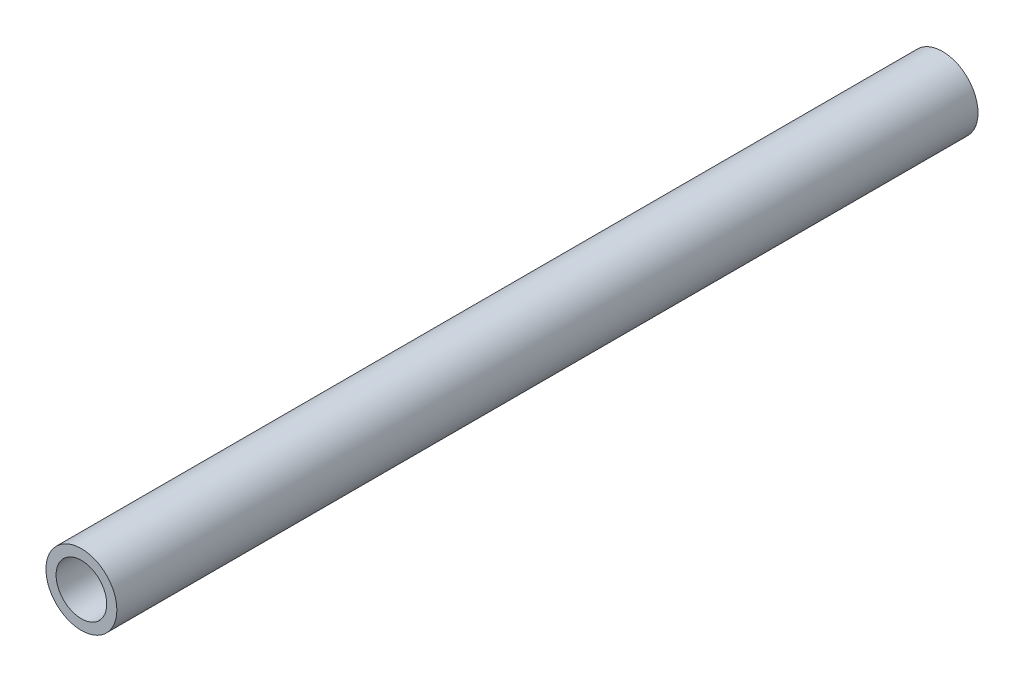
from build123d import *

# Parameters (mm, degrees)
SKETCH1_R           = 70
SKETCH1_R_2         = 50
BOSS_EXTRUDE1_DEPTH = 850


with BuildPart() as part:
    # Sketch1 → Boss-Extrude1 (new, symmetric)
    with BuildSketch(Plane.XY):
        Circle(SKETCH1_R)
        Circle(SKETCH1_R_2, mode=Mode.SUBTRACT)
    extrude(amount=BOSS_EXTRUDE1_DEPTH, both=True)


solid = part.part
